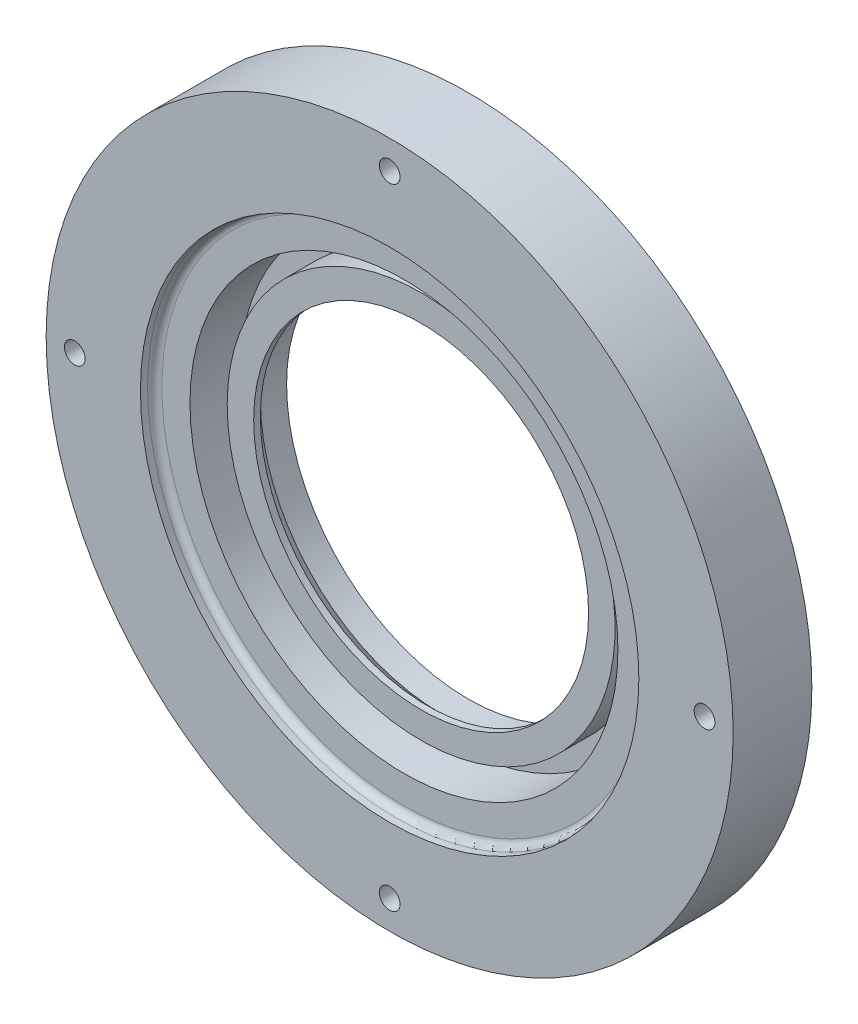
from build123d import *

# Parameters (mm, degrees)
FILLET1_R                        = 1
CBORE_FOR_M2_5_SHCS1_D           = 2.9
CBORE_FOR_M2_5_SHCS1_DEPTH       = 11
CBORE_FOR_M2_5_SHCS1_CBORE_D     = 5.5
CBORE_FOR_M2_5_SHCS1_CBORE_DEPTH = 5.5
CBORE_FOR_M2_5_SHCS1_TIP         = 0.871247898


with BuildPart() as part:
    # Sketch2 → Revolve1 (revolve)
    with BuildSketch(Plane(origin=(149.116436894, 233.039279035, -142.529295826), x_dir=(0.7966051698338124, 0.6044999614508201, 0), z_dir=(-0.6044999614508201, 0.7966051698338124, 0)), mode=Mode.PRIVATE) as revolve1_sk:
        Polygon((-23.4, 2.4), (-23.4, 3.334314575), (-25.4, 5.334314575), (-25.4, 9), (-48, 9), (-48, -2), (-34.825, -2), (-34.825, 0), (-29.9, 0), (-29.9, 7), (-27.1, 7), (-27.1, 2.4), align=None)
    revolve(revolve1_sk.sketch.rotate(Axis((149.116436894, 233.039279035, -155.970002237), (0, 0, 1)), 322.80713194), axis=Axis((149.116436894, 233.039279035, -155.970002237), (0, 0, 1)))

    # Fillet1
    fillet1_edges = [part.edges().sort_by_distance(p)[0] for p in [
        (183.941436894, 233.039279035, -142.529295826),
    ]]
    fillet(fillet1_edges, radius=FILLET1_R)

    # CBORE for M2.5 SHCS1
    with Locations(Plane(origin=(0, 0, -151.529295826), x_dir=(-1, 0, 0), z_dir=(0, 0, -1))):
        with Locations((-149.116436894, 277.039279035), (-149.116436894, 189.039279035), (-105.116436894, 233.039279035), (-193.116436894, 233.039279035)):
            CounterBoreHole(CBORE_FOR_M2_5_SHCS1_D / 2, CBORE_FOR_M2_5_SHCS1_CBORE_D / 2, CBORE_FOR_M2_5_SHCS1_CBORE_DEPTH, depth=CBORE_FOR_M2_5_SHCS1_DEPTH)
            with Locations((0, 0, -(CBORE_FOR_M2_5_SHCS1_DEPTH + CBORE_FOR_M2_5_SHCS1_TIP / 2))):  # 118° drill point
                Cone(0, CBORE_FOR_M2_5_SHCS1_D / 2, CBORE_FOR_M2_5_SHCS1_TIP, mode=Mode.SUBTRACT)


solid = part.part
